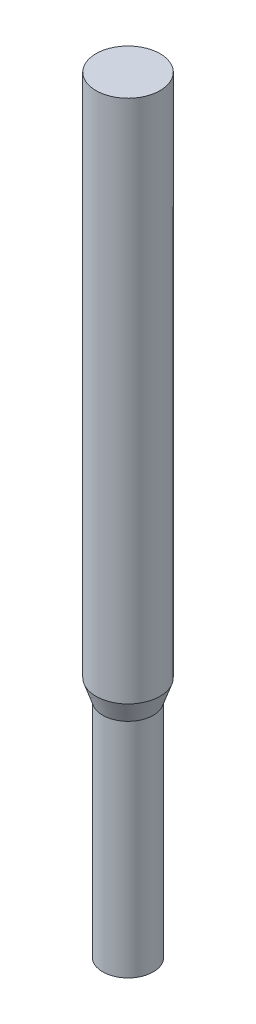
from build123d import *


with BuildPart() as part:
    # Sketch1 → Revolve1 (revolve)
    with BuildSketch(Plane.XY, mode=Mode.PRIVATE) as revolve1_sk:
        Polygon((0, 0), (-1.5875, 0), (-1.5875, -26), (-1.25, -26.983888861), (-1.25, -38), (0, -38), align=None)
    revolve(revolve1_sk.sketch.rotate(Axis((0, -38, 0), (0, 1, 0)), 270), axis=Axis((0, -38, 0), (0, 1, 0)))


solid = part.part
